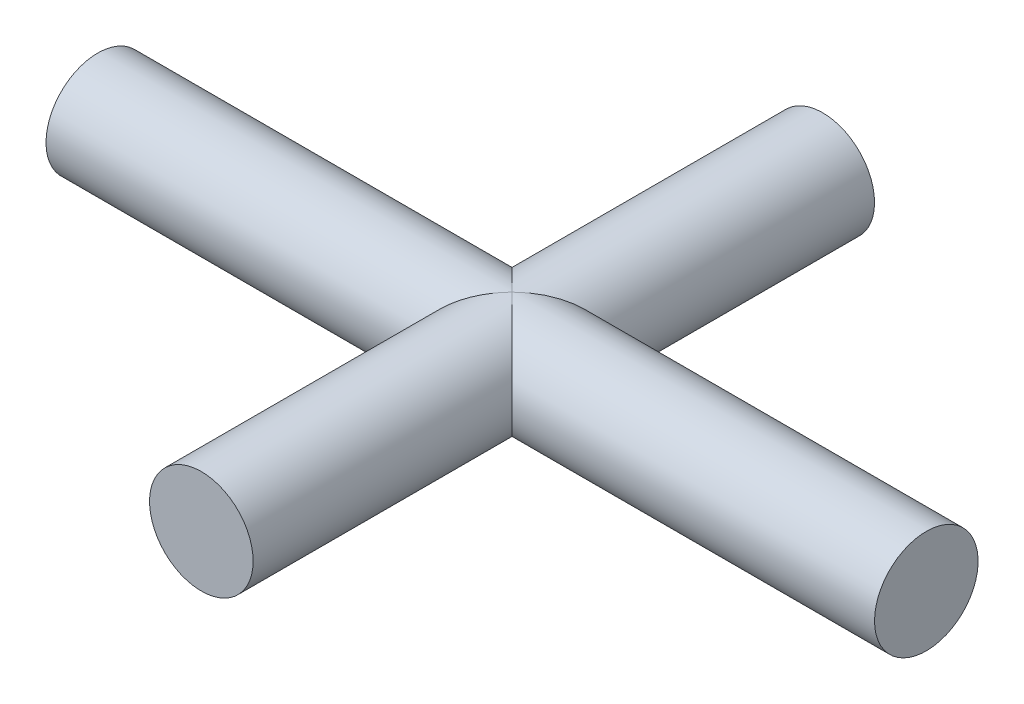
from build123d import *

# Parameters (mm, degrees)
SKETCH_1_W = 80
SKETCH_1_H = 5
SKETCH_2_W = 5
SKETCH_2_H = 60


with BuildPart() as part:
    # 草图1 → 旋转1 (revolve)
    with BuildSketch(Plane.XY, mode=Mode.PRIVATE) as revolve_1_sk:
        with Locations((0, 2.5)):
            Rectangle(SKETCH_1_W, SKETCH_1_H)
    revolve(revolve_1_sk.sketch.rotate(Axis((-40, 0, 0), (1, 0, 0)), 90), axis=Axis((-40, 0, 0), (1, 0, 0)))

    # 草图2 → 旋转2 (revolve)
    with BuildSketch(Plane(origin=(0, 0, 0), x_dir=(1, 0, 0), z_dir=(0, 1, 0))):
        with Locations((2.5, 0)):
            Rectangle(SKETCH_2_W, SKETCH_2_H)
    revolve(axis=Axis((0, 0, 30), (0, 0, -1)))


solid = part.part
